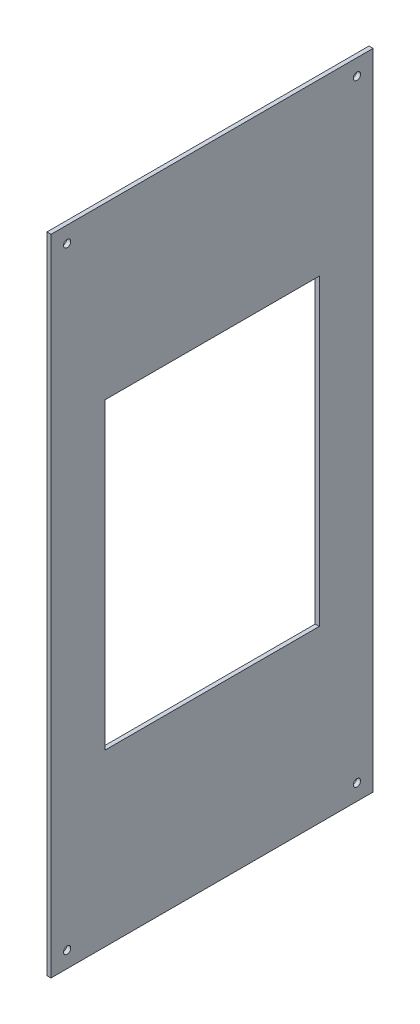
from build123d import *

# Parameters (mm, degrees)
SKETCH1_W           = 500
SKETCH1_H           = 250
SKETCH1_R           = 2.8
BOSS_EXTRUDE1_DEPTH = 3.175
SKETCH2_W           = 235.5
SKETCH2_H           = 166.5
CUT_EXTRUDE1_DEPTH  = 280.526529376


with BuildPart() as part:
    # Sketch1 → Boss-Extrude1 (new body)
    with BuildSketch(Plane.YZ):
        Rectangle(SKETCH1_W, SKETCH1_H)
        with Locations(Location((-237.5, 112.5, 0), (0, 0, 270))):
            Circle(SKETCH1_R, mode=Mode.SUBTRACT)
        with Locations(Location((237.5, 112.5, 0), (0, 0, 90))):
            Circle(SKETCH1_R, mode=Mode.SUBTRACT)
        with Locations(Location((237.5, -112.5, 0), (0, 0, 270))):
            Circle(SKETCH1_R, mode=Mode.SUBTRACT)
        with Locations(Location((-237.5, -112.5, 0), (0, 0, 90))):
            Circle(SKETCH1_R, mode=Mode.SUBTRACT)
    extrude(amount=BOSS_EXTRUDE1_DEPTH)

    # Sketch2 → Cut-Extrude1 (cut, through all)
    with BuildSketch(Plane.YZ.offset(3.175)):
        Rectangle(SKETCH2_W, SKETCH2_H)
    extrude(amount=-CUT_EXTRUDE1_DEPTH, mode=Mode.SUBTRACT)


solid = part.part
